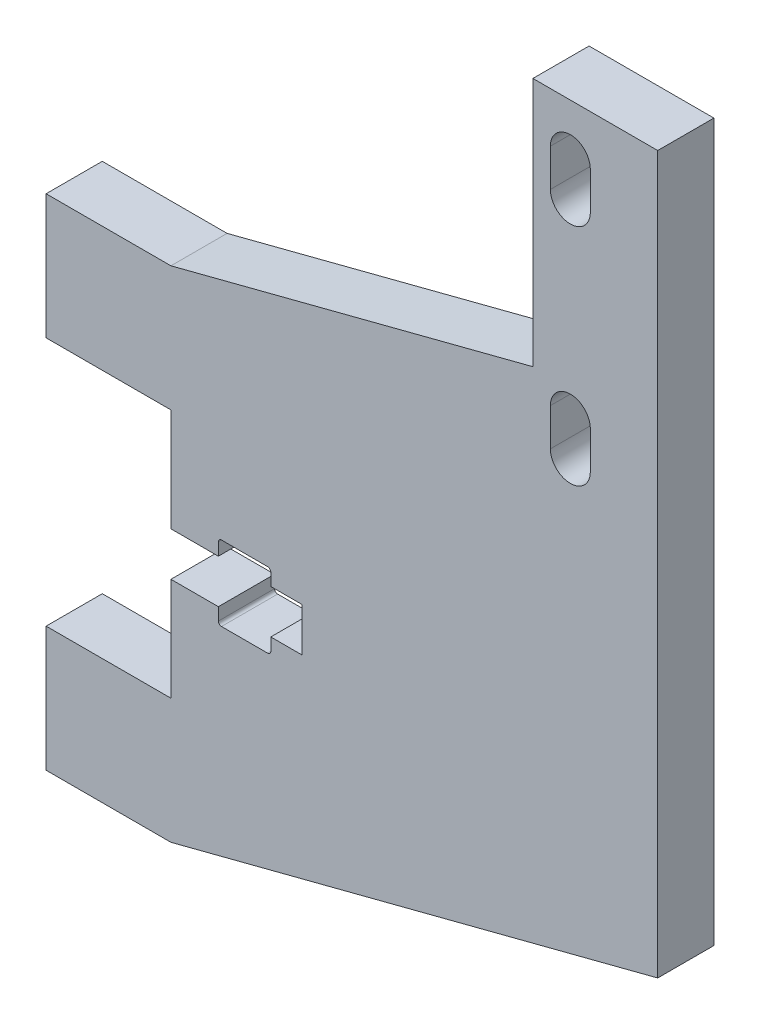
from build123d import *

# Parameters (mm, degrees)
BOSS_EXTRUDE1_DEPTH = 4.5
SCREW_CUTOUT_DEPTH  = 60.718087712
CUT_EXTRUDE2_DEPTH  = 60.718087712


with BuildPart() as part:
    # Sketch1 → Boss-Extrude1 (new body)
    with BuildSketch(Plane.XY):
        Polygon((29, 2.5), (0, -5), (-10, -5), (-10, -15), (0, -15), (0, -35), (-10, -35), (-10, -45), (0, -45), (39, -34.913793103), (39, 22.5), (29, 22.5), align=None)
    extrude(amount=BOSS_EXTRUDE1_DEPTH)

    # Sketch2 → screw-cutout (cut, through all)
    with BuildSketch(Plane.XY.offset(4.5)):
        with BuildLine():
            Line((0, -26.75), (0, -23.25))
            Line((0, -23.25), (3.8, -23.25))
            Line((3.8, -23.25), (3.8, -22.25))
            ThreePointArc((3.8, -22.25), (3.873223305, -22.073223305), (4.05, -22))
            Line((4.05, -22), (7.75, -22))
            ThreePointArc((7.75, -22), (7.926776695, -22.073223305), (8, -22.25))
            Line((8, -22.25), (8, -23.25))
            Line((8, -23.25), (10.5, -23.25))
            Line((10.5, -23.25), (10.5, -26.75))
            Line((10.5, -26.75), (8, -26.75))
            Line((8, -26.75), (8, -27.75))
            ThreePointArc((8, -27.75), (7.926776695, -27.926776695), (7.75, -28))
            Line((7.75, -28), (4.05, -28))
            ThreePointArc((4.05, -28), (3.873223305, -27.926776695), (3.8, -27.75))
            Line((3.8, -27.75), (3.8, -26.75))
            Line((3.8, -26.75), (0, -26.75))
        make_face()
    extrude(amount=-SCREW_CUTOUT_DEPTH, mode=Mode.SUBTRACT)

    # Sketch3 → Cut-Extrude2 (cut, through all)
    with BuildSketch(Plane.XY.offset(4.5)):
        with BuildLine():
            Line((33.6, 18.5), (33.6, 15.5))
            ThreePointArc((33.6, 15.5), (32, 13.9), (30.4, 15.5))
            Line((30.4, 15.5), (30.4, 18.5))
            ThreePointArc((30.4, 18.5), (32, 20.1), (33.6, 18.5))
        make_face()
        with BuildLine():
            Line((33.6, 0.5), (33.6, -2.5))
            ThreePointArc((33.6, -2.5), (32, -4.1), (30.4, -2.5))
            Line((30.4, -2.5), (30.4, 0.5))
            ThreePointArc((30.4, 0.5), (32, 2.1), (33.6, 0.5))
        make_face()
    extrude(amount=-CUT_EXTRUDE2_DEPTH, mode=Mode.SUBTRACT)


solid = part.part
